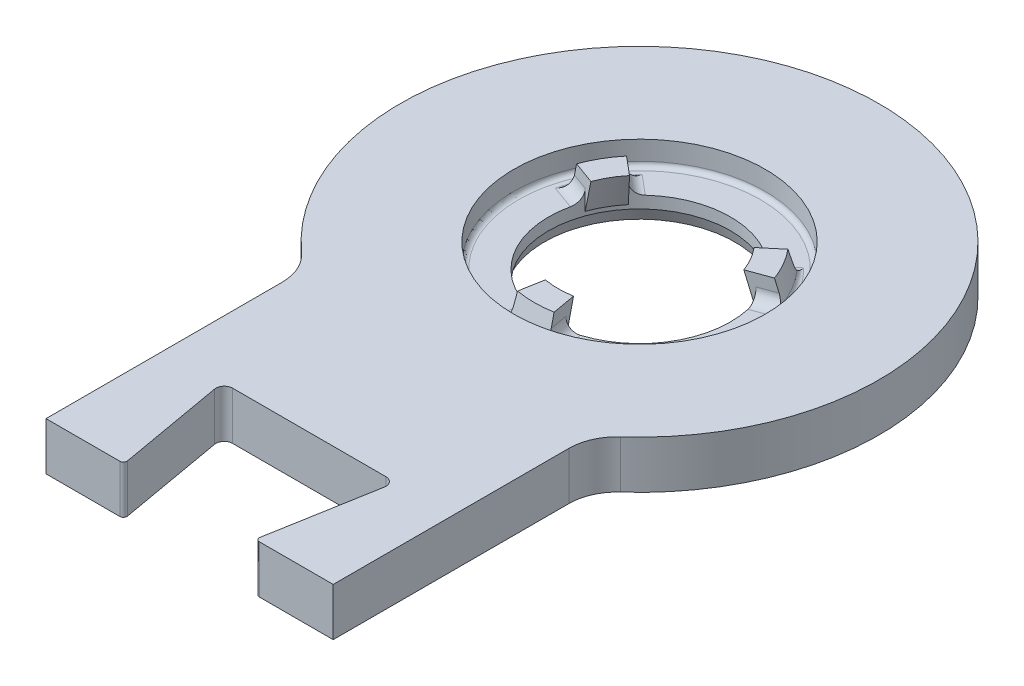
from build123d import *

# Parameters (mm, degrees)
SKETCH1_R           = 4
BOSS_EXTRUDE1_DEPTH = 2
SKETCH2_R           = 10
SKETCH2_R_2         = 3.8
BOSS_EXTRUDE2_DEPTH = 2
SKETCH4_W           = 12
SKETCH4_H           = 0.2
CUT_EXTRUDE1_DEPTH  = 4
FILLET3_R           = 0.35
FILLET4_R           = 0.15
FILLET6_R           = 2
SKETCH13_R          = 5.25
CUT_EXTRUDE5_DEPTH  = 1
REVOLVE2_ANGLE      = 20
CIRPATTERN2_COUNT   = 3
CHAMFER1_SIZE       = 0.5
CHAMFER1_SIZE2      = 0.181985117
FILLET13_R          = 0.5
FILLET14_R          = 0.2


with BuildPart() as part:
    # Sketch1 → Boss-Extrude1 (new body)
    with BuildSketch(Plane(origin=(0, 0, 0), x_dir=(1, 0, 0), z_dir=(0, 1, 0))):
        Polygon((-6, 6), (-6, -13.291502622), (-6, -19), (-2.70227506, -19), (-3.619175359, -13.8), (0, -13.8), (3.619175359, -13.8), (2.70227506, -19), (6, -19), (6, -13.291502622), (6, 6), align=None)
        with Locations(Location((0, 0, 0), (0, 0, 270))):
            Circle(SKETCH1_R, mode=Mode.SUBTRACT)
    extrude(amount=BOSS_EXTRUDE1_DEPTH)

    # Sketch2 → Boss-Extrude2 (add)
    with BuildSketch(Plane(origin=(0, 0, 0), x_dir=(1, 0, 0), z_dir=(0, 1, 0))):
        Circle(SKETCH2_R)
        with Locations(Location((0, 0, 0), (0, 0, 270))):
            Circle(SKETCH2_R_2, mode=Mode.SUBTRACT)
    extrude(amount=BOSS_EXTRUDE2_DEPTH)

    # Sketch4 → Cut-Extrude1 (cut)
    with BuildSketch(Plane(origin=(0, 2, 0), x_dir=(1, 0, 0), z_dir=(0, 1, 0))):
        with Locations((0, -18.9)):
            Rectangle(SKETCH4_W, SKETCH4_H)
    extrude(amount=-CUT_EXTRUDE1_DEPTH, mode=Mode.SUBTRACT)

    # Fillet3
    fillet3_edges = [part.edges().sort_by_distance(p)[0] for p in [
        (3.619175359, 1, 13.8),
        (-3.619175359, 1, 13.8),
    ]]
    fillet(fillet3_edges, radius=FILLET3_R)

    # Fillet4
    fillet4_edges = [part.edges().sort_by_distance(p)[0] for p in [
        (2.737540456, 1, 18.8),
        (-2.737540456, 1, 18.8),
    ]]
    fillet(fillet4_edges, radius=FILLET4_R)

    # Fillet6
    fillet6_edges = [part.edges().sort_by_distance(p)[0] for p in [
        (6, 1, 8),
        (-6, 1, 8),
    ]]
    fillet(fillet6_edges, radius=FILLET6_R)

    # Sketch13 → Cut-Extrude5 (cut)
    with BuildSketch(Plane(origin=(0, 2, 0), x_dir=(1, 0, 0), z_dir=(0, 1, 0))):
        with Locations(Location((0, 0, 0), (0, 0, 270))):
            Circle(SKETCH13_R)
    extrude(amount=-CUT_EXTRUDE5_DEPTH, mode=Mode.SUBTRACT)

    # Sketch12 → Revolve2 (revolve, symmetric)
    with BuildSketch(Plane(origin=(0, 0, 0), x_dir=(0, 0, -1), z_dir=(1, 0, 0))) as revolve2_sk:
        Polygon((-4, 0), (-3.4, 2), (-4.4, 2), (-5, 0), align=None)
    revolve2 = revolve(axis=Axis((0, 0, 0), (0, 1, 0)), revolution_arc=REVOLVE2_ANGLE / 2)
    revolve2 = revolve2 + revolve(revolve2_sk.sketch, axis=Axis((0, 0, 0), (0, -1, 0)), revolution_arc=REVOLVE2_ANGLE / 2)

    # CirPattern2: Revolve2 ×3 about axis
    cirpattern2_axis = Axis((0, 0, 0), (0, 1, 0))
    for i in range(1, CIRPATTERN2_COUNT):
        add(revolve2.rotate(cirpattern2_axis, i * 360 / CIRPATTERN2_COUNT))

    # Chamfer1
    chamfer1_edges = [part.edges().sort_by_distance(p)[0] for p in [
        (0, 0, -3.8),
    ]]
    chamfer1_side = [part.faces().sort_by_distance(p)[0] for p in [
        (0, 0.5, -3.8),
    ]]
    chamfer(chamfer1_edges, length=CHAMFER1_SIZE, length2=CHAMFER1_SIZE2, reference=chamfer1_side[0])

    # Fillet13
    fillet13_edges = [part.edges().sort_by_distance(p)[0] for p in [
        (-0.738004755, 1, 4.18543295),
        (0.738004755, 1, 4.18543295),
        (-3.255688883, 1, -2.731847341),
        (-3.993693638, 1, -1.453585609),
        (3.993693638, 1, -1.453585609),
        (3.255688883, 1, -2.731847341),
    ]]
    fillet(fillet13_edges, radius=FILLET13_R)

    # Fillet14
    fillet14_edges = [part.edges().sort_by_distance(p)[0] for p in [
        (0, 1, -5.25),
        (-4.070319398, 1, -2.35),
        (4.070319398, 1, -2.35),
        (0, 1, 4.7),
    ]]
    fillet(fillet14_edges, radius=FILLET14_R)


solid = part.part
